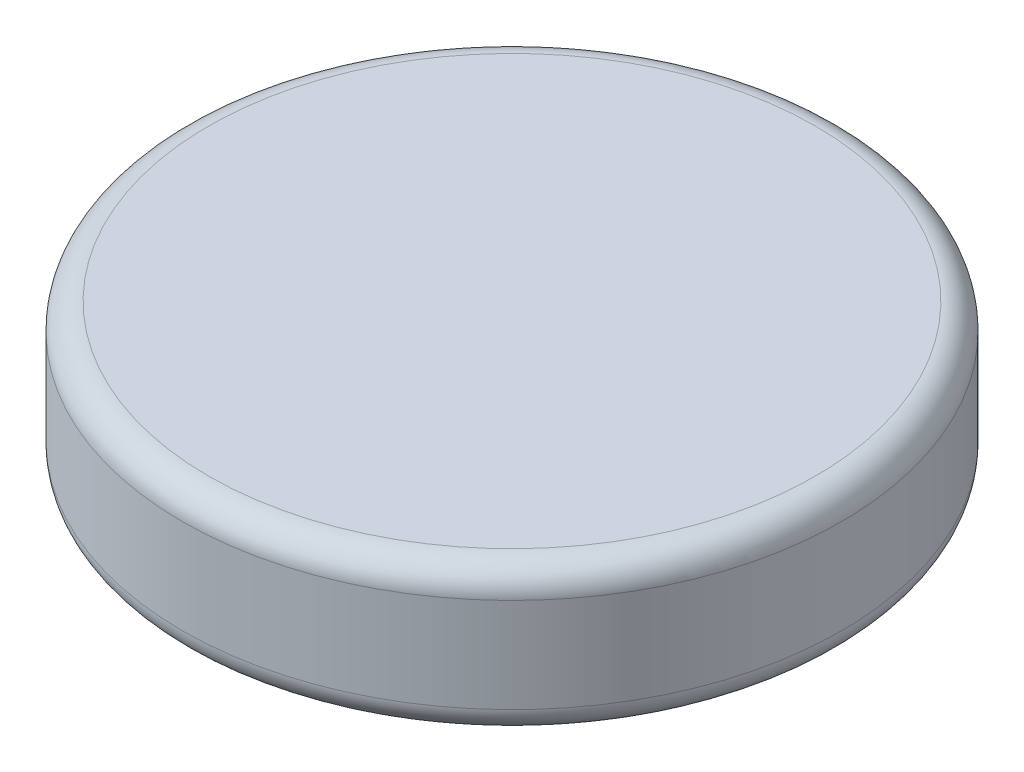
from build123d import *

# Parameters (mm, degrees)
SKETCH1_R           = 15.9385
BOSS_EXTRUDE1_DEPTH = 7.112
FILLET1_R           = 1.27


with BuildPart() as part:
    # Sketch1 → Boss-Extrude1 (new body)
    with BuildSketch(Plane(origin=(0, 0, 0), x_dir=(1, 0, 0), z_dir=(0, 1, 0))):
        with Locations(Location((0, 0, 0), (0, 0, 270))):
            Circle(SKETCH1_R)
    extrude(amount=BOSS_EXTRUDE1_DEPTH)

    # Fillet1
    fillet1_edges = [part.edges().sort_by_distance(p)[0] for p in [
        (0, 0, -15.9385),
        (0, 7.112, -15.9385),
    ]]
    fillet(fillet1_edges, radius=FILLET1_R)


solid = part.part
